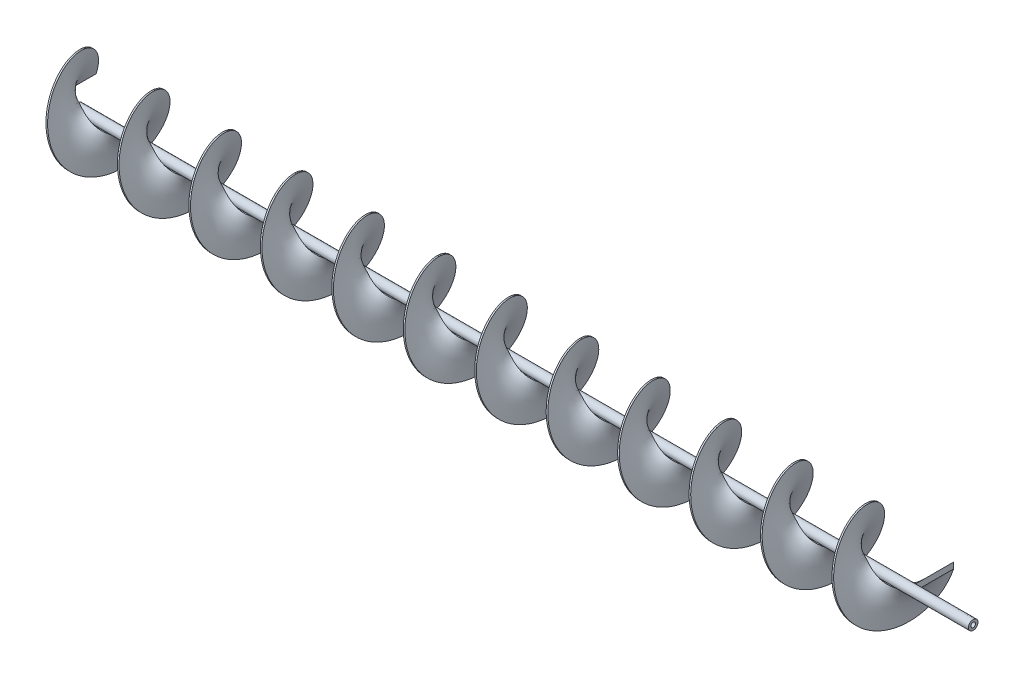
from build123d import *

# Parameters (mm, degrees)
AUFSATZ_LINEAR_AUSTRAGEN1_DEPTH      = 51.5
AUFSATZ_LINEAR_AUSTRAGEN1_DEPTH_BACK = 700
SKIZZE3_R                            = 4
SKIZZE3_R_2                          = 2
AUSTRAGUNG1_PITCH                    = 60
AUSTRAGUNG1_HEIGHT                   = 720
AUSTRAGUNG1_RADIUS                   = 4
SKIZZE2_W                            = 31
SKIZZE2_H                            = 5


with BuildPart() as part:
    # Skizze3 → Aufsatz-Linear austragen1 (new, two sides: drawn at the far end of the back side and taken through both)
    with BuildSketch(Plane(origin=(0, 0, 0), x_dir=(0, 0, -1), z_dir=(1, 0, 0)).offset(-AUFSATZ_LINEAR_AUSTRAGEN1_DEPTH_BACK)):
        Circle(SKIZZE3_R)
        Circle(SKIZZE3_R_2, mode=Mode.SUBTRACT)
    extrude(amount=AUFSATZ_LINEAR_AUSTRAGEN1_DEPTH + AUFSATZ_LINEAR_AUSTRAGEN1_DEPTH_BACK)


with BuildPart() as body_2:
    # Austragung1: sweep along a helix
    with BuildLine() as austragung1_path:
        Helix(AUSTRAGUNG1_PITCH, AUSTRAGUNG1_HEIGHT, AUSTRAGUNG1_RADIUS, center=(0, 0, 0), direction=(-1, 0, 0))
    # Skizze2 → Austragung1 (sweep)
    with BuildSketch(Plane(origin=(0, 0, 0), x_dir=(0, 0, -1), z_dir=(1, 0, 0))):
        with Locations((19.5, 0)):
            Rectangle(SKIZZE2_W, SKIZZE2_H)
    sweep(path=austragung1_path.line, is_frenet=True)


solid = Compound([part.part, body_2.part])
